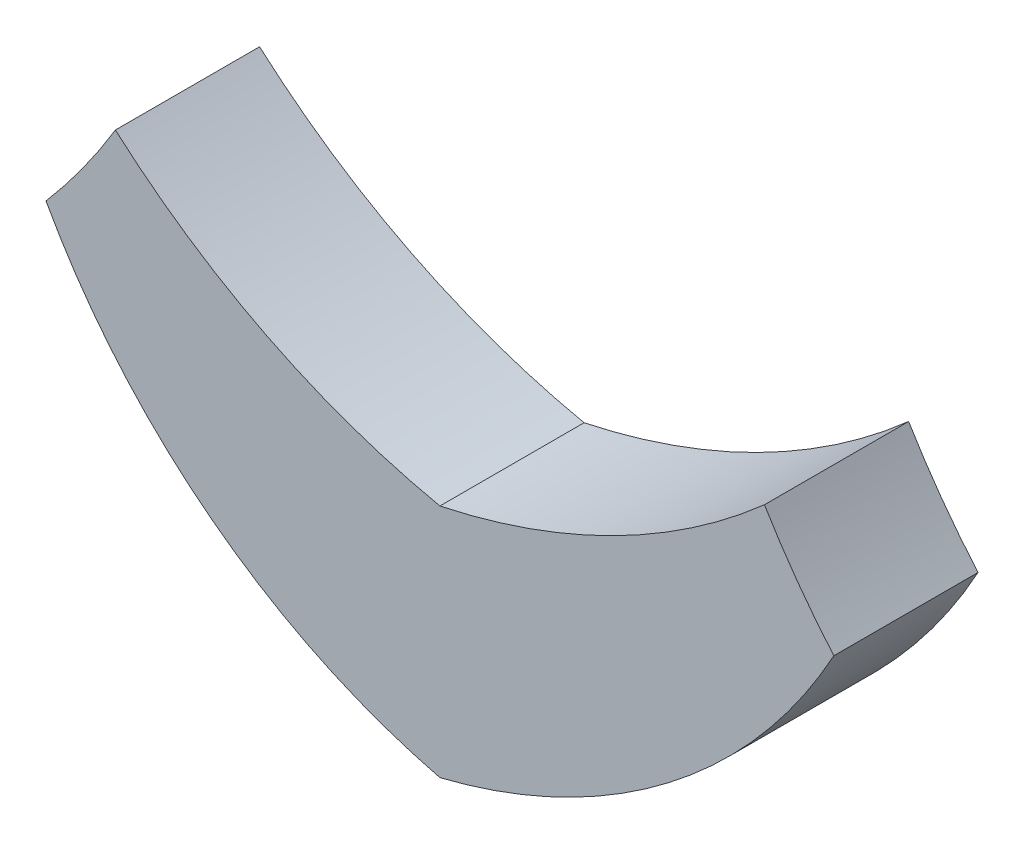
from build123d import *

# Parameters (mm, degrees)
BOSS_EXTRUDE1_DEPTH = 5


with BuildPart() as part:
    # Sketch1 → Boss-Extrude1 (new body)
    with BuildSketch(Plane.XY):
        with BuildLine():
            ThreePointArc((-12.983067388, 6.118559097), (-11.710745891, 7.734822311), (-10.577139347, 9.451226975))
            ThreePointArc((-10.577139347, 9.451226975), (-9.313293399, 8.406652262), (-7.983008658, 7.448119311))
            ThreePointArc((-7.983008658, 7.448119311), (-3.828474377, 5.202168871), (0.677245379, 3.78691697))
            ThreePointArc((0.677245379, 3.78691697), (5.182965136, 5.202168871), (9.337499417, 7.448119311))
            ThreePointArc((9.337499417, 7.448119311), (10.667784158, 8.406652262), (11.931630106, 9.451226975))
            ThreePointArc((11.931630106, 9.451226975), (13.065236649, 7.734822311), (14.337558146, 6.118559097))
            ThreePointArc((14.337558146, 6.118559097), (12.119892503, 2.841112967), (9.337499417, 0.027221931))
            ThreePointArc((9.337499417, 0.027221931), (5.25986118, -2.66939146), (0.677245379, -4.37188663))
            ThreePointArc((0.677245379, -4.37188663), (-3.905370421, -2.66939146), (-7.983008658, 0.027221931))
            ThreePointArc((-7.983008658, 0.027221931), (-10.765401744, 2.841112967), (-12.983067388, 6.118559097))
        make_face()
    extrude(amount=BOSS_EXTRUDE1_DEPTH)


solid = part.part
